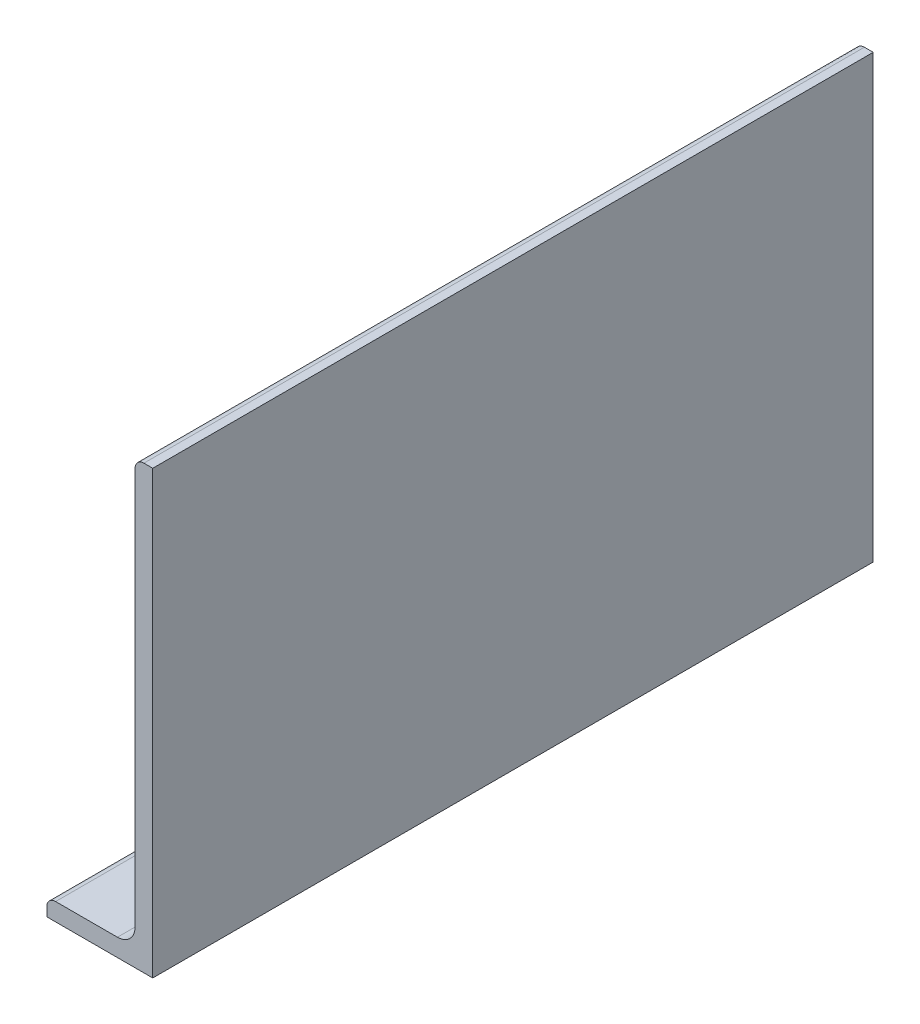
from build123d import *

# Parameters (mm, degrees)
BOSS_EXTRUDE1_DEPTH = 81.6
FILLET1_R           = 1
FILLET2_R           = 2
SKETCH2_R           = 1.6
CUT_EXTRUDE1_DEPTH  = 1160.889353037


with BuildPart() as part:
    # Sketch1 → Boss-Extrude1 (new body)
    with BuildSketch(Plane.XY):
        Polygon((1156.019355932, -193.247714945), (1156.019355932, -243.247714945), (1144.019355932, -243.247714945), (1144.019355932, -241.247714945), (1154.019355932, -241.247714945), (1154.019355932, -193.247714945), align=None)
    extrude(amount=BOSS_EXTRUDE1_DEPTH)

    # Fillet1
    fillet1_edges = [part.edges().sort_by_distance(p)[0] for p in [
        (1144.019355932, -241.247714945, 40.8),
        (1154.019355932, -193.247714945, 40.8),
    ]]
    fillet(fillet1_edges, radius=FILLET1_R)

    # Fillet2
    fillet2_edges = [part.edges().sort_by_distance(p)[0] for p in [
        (1154.019355932, -241.247714945, 40.8),
    ]]
    fillet(fillet2_edges, radius=FILLET2_R)

    # Sketch2 → Cut-Extrude1 (cut, through all)
    with BuildSketch(Plane(origin=(0, -241.247714945, 0), x_dir=(1, 0, 0), z_dir=(0, 1, 0))):
        with Locations(Location((1148.519355932, -61.6, 0), (0, 0, 270))):
            Circle(SKETCH2_R)
        with Locations(Location((1148.519355932, -20, 0), (0, 0, 270))):
            Circle(SKETCH2_R)
    extrude(amount=-CUT_EXTRUDE1_DEPTH, mode=Mode.SUBTRACT)


solid = part.part
